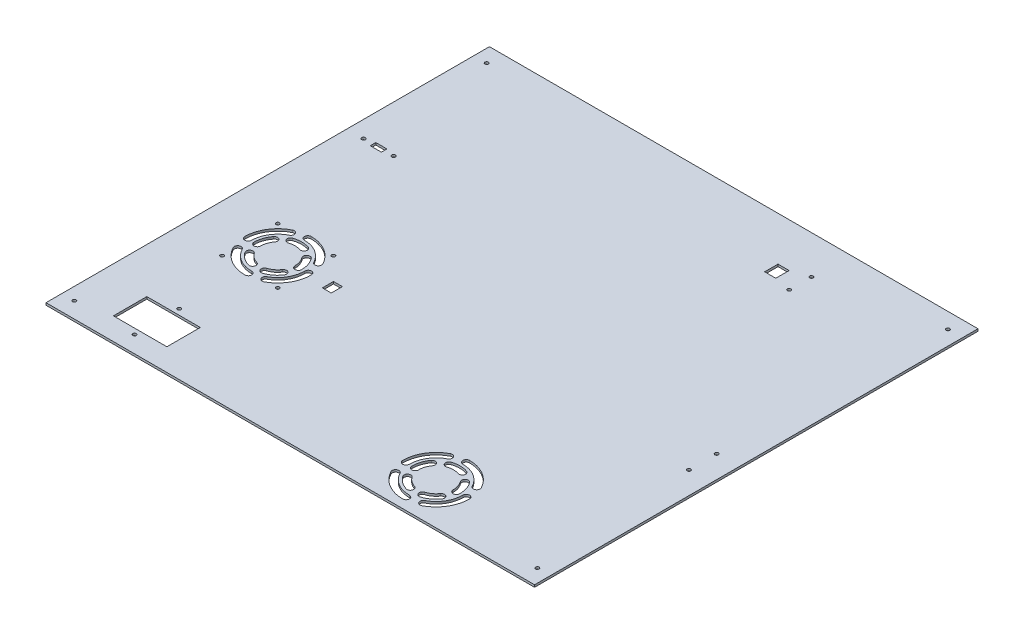
from build123d import *

# Parameters (mm, degrees)
CROQUIS1_W              = 440.5
CROQUIS1_H              = 320
SALIENTE_EXTRUIR1_DEPTH = 2
CROQUIS2_R              = 1.55
CORTAR_EXTRUIR1_DEPTH   = 2
CROQUIS3_W              = 440.5
CROQUIS3_H              = 320
CROQUIS3_W_2            = 439
CROQUIS3_H_2            = 318.5
CORTAR_EXTRUIR2_DEPTH   = 2
CROQUIS4_R              = 1.55
CORTAR_EXTRUIR3_DEPTH   = 2
CROQUIS5_R              = 1.55
CROQUIS5_W              = 48
CROQUIS5_H              = 30
CORTAR_EXTRUIR4_DEPTH   = 2
CROQUIS8_W              = 439
CROQUIS8_H              = 30
SALIENTE_EXTRUIR2_DEPTH = 2
CROQUIS10_R             = 1.75
SALIENTE_EXTRUIR3_DEPTH = 2
CROQUIS11_W             = 439
CROQUIS11_H             = 2
SALIENTE_EXTRUIR4_DEPTH = 50
CROQUIS12_R             = 1.55
CORTAR_EXTRUIR8_DEPTH   = 2
CROQUIS13_R             = 1.55
CROQUIS13_W             = 10
CROQUIS13_H             = 12
CORTAR_EXTRUIR9_DEPTH   = 2
CROQUIS14_W             = 8
CROQUIS14_H             = 10
CORTAR_EXTRUIR10_DEPTH  = 2
CROQUIS15_R             = 1.6
CORTAR_EXTRUIR11_DEPTH  = 2
CROQUIS18_W             = 0.5
CROQUIS18_H             = 398
CORTAR_EXTRUIR13_DEPTH  = 2
CROQUIS19_R             = 1.65
CROQUIS19_W             = 10
CROQUIS19_H             = 5
CORTAR_EXTRUIR14_DEPTH  = 2


with BuildPart() as part:
    # Croquis1 → Saliente-Extruir1 (new body)
    with BuildSketch(Plane(origin=(0, 0, 0), x_dir=(1, 0, 0), z_dir=(0, 1, 0))):
        with Locations((220.25, 160)):
            Rectangle(CROQUIS1_W, CROQUIS1_H)
    extrude(amount=SALIENTE_EXTRUIR1_DEPTH)

    # Croquis2 → Cortar-Extruir1 (cut)
    with BuildSketch(Plane(origin=(0, 2, 0), x_dir=(1, 0, 0), z_dir=(0, 1, 0))):
        with Locations(Location((12.5, 305, 0), (0, 0, 270))):
            Circle(CROQUIS2_R)
        with Locations(Location((428, 305, 0), (0, 0, 90))):
            Circle(CROQUIS2_R)
        with Locations(Location((428, 15, 0), (0, 0, 270))):
            Circle(CROQUIS2_R)
        with Locations(Location((12.5, 15, 0), (0, 0, 90))):
            Circle(CROQUIS2_R)
    extrude(amount=-CORTAR_EXTRUIR1_DEPTH, mode=Mode.SUBTRACT)

    # Croquis3 → Cortar-Extruir2 (cut)
    with BuildSketch(Plane(origin=(0, 2, 0), x_dir=(1, 0, 0), z_dir=(0, 1, 0))):
        with Locations((220.25, 160)):
            Rectangle(CROQUIS3_W, CROQUIS3_H)
        with Locations((220.25, 160)):
            Rectangle(CROQUIS3_W_2, CROQUIS3_H_2, mode=Mode.SUBTRACT)
    extrude(amount=-CORTAR_EXTRUIR2_DEPTH, mode=Mode.SUBTRACT)

    # Croquis4 → Cortar-Extruir3 (cut)
    with BuildSketch(Plane(origin=(0, 2, 0), x_dir=(1, 0, 0), z_dir=(0, 1, 0))):
        with Locations(Location((93.75, 166.25, 0), (0, 0, 270))):
            Circle(CROQUIS4_R)
        with Locations(Location((93.75, 116.25, 0), (0, 0, 270))):
            Circle(CROQUIS4_R)
        with Locations(Location((43.75, 116.25, 0), (0, 0, 270))):
            Circle(CROQUIS4_R)
        with Locations(Location((43.75, 166.25, 0), (0, 0, 270))):
            Circle(CROQUIS4_R)
        with BuildLine():
            ThreePointArc((340.502065733, 52.118312757), (329.455555556, 63.901991957), (313.9, 68.25))
            ThreePointArc((313.9, 68.25), (310.9, 65.25), (313.9, 62.25))
            ThreePointArc((313.9, 62.25), (326.344444444, 58.771593566), (335.181652586, 49.344650206))
            ThreePointArc((335.181652586, 49.344650206), (339.228690436, 48.071274908), (340.502065733, 52.118312757))
        make_face()
        with BuildLine():
            ThreePointArc((324.994650206, 16.968347414), (334.421593566, 25.805555556), (337.9, 38.25))
            ThreePointArc((337.9, 38.25), (340.9, 41.25), (343.9, 38.25))
            ThreePointArc((343.9, 38.25), (339.551991957, 22.694444444), (327.768312757, 11.647934267))
            ThreePointArc((327.768312757, 11.647934267), (323.721274908, 12.921309564), (324.994650206, 16.968347414))
        make_face()
        with BuildLine():
            ThreePointArc((292.618347414, 27.155349794), (301.455555556, 17.728406434), (313.9, 14.25))
            ThreePointArc((313.9, 14.25), (316.9, 11.25), (313.9, 8.25))
            ThreePointArc((313.9, 8.25), (298.344444444, 12.598008043), (287.297934267, 24.381687243))
            ThreePointArc((287.297934267, 24.381687243), (288.571309564, 28.428725092), (292.618347414, 27.155349794))
        make_face()
        with BuildLine():
            ThreePointArc((302.805349794, 59.531652586), (293.378406434, 50.694444444), (289.9, 38.25))
            ThreePointArc((289.9, 38.25), (286.9, 35.25), (283.9, 38.25))
            ThreePointArc((283.9, 38.25), (288.248008043, 53.805555556), (300.031687243, 64.852065733))
            ThreePointArc((300.031687243, 64.852065733), (304.078725092, 63.578690436), (302.805349794, 59.531652586))
        make_face()
        with BuildLine():
            ThreePointArc((320.872972973, 58.587837838), (313.9, 59.75), (306.927027027, 58.587837838))
            ThreePointArc((306.927027027, 58.587837838), (305.062162162, 54.777027027), (308.872972973, 52.912162162))
            ThreePointArc((308.872972973, 52.912162162), (313.9, 53.75), (318.927027027, 52.912162162))
            ThreePointArc((318.927027027, 52.912162162), (322.737837838, 54.777027027), (320.872972973, 58.587837838))
        make_face()
        with BuildLine():
            ThreePointArc((335.397200353, 37.903046137), (334.3477151, 44.893865379), (331.087666053, 51.166428905))
            ThreePointArc((331.087666053, 51.166428905), (326.887094664, 51.762415483), (326.291108085, 47.561844094))
            ThreePointArc((326.291108085, 47.561844094), (328.641376003, 43.039763413), (329.39798165, 37.999870471))
            ThreePointArc((329.39798165, 37.999870471), (332.349178834, 34.951848952), (335.397200353, 37.903046137))
        make_face()
        with BuildLine():
            ThreePointArc((320.213027508, 17.697732882), (326.537382924, 20.856134621), (331.495534781, 25.894954238))
            ThreePointArc((331.495534781, 25.894954238), (330.764303755, 30.074105012), (326.585152982, 29.342873986))
            ThreePointArc((326.585152982, 29.342873986), (323.010671411, 25.710236587), (318.45125239, 23.433249287))
            ThreePointArc((318.45125239, 23.433249287), (316.464381746, 19.684603525), (320.213027508, 17.697732882))
        make_face()
        with BuildLine():
            ThreePointArc((296.304465219, 25.894954238), (301.262617076, 20.856134621), (307.586972492, 17.697732882))
            ThreePointArc((307.586972492, 17.697732882), (311.335618254, 19.684603525), (309.34874761, 23.433249287))
            ThreePointArc((309.34874761, 23.433249287), (304.789328589, 25.710236587), (301.214847018, 29.342873986))
            ThreePointArc((301.214847018, 29.342873986), (297.035696245, 30.074105012), (296.304465219, 25.894954238))
        make_face()
        with BuildLine():
            ThreePointArc((296.712333947, 51.166428905), (293.4522849, 44.893865379), (292.402799647, 37.903046137))
            ThreePointArc((292.402799647, 37.903046137), (295.450821166, 34.951848952), (298.40201835, 37.999870471))
            ThreePointArc((298.40201835, 37.999870471), (299.158623997, 43.039763413), (301.508891915, 47.561844094))
            ThreePointArc((301.508891915, 47.561844094), (300.912905336, 51.762415483), (296.712333947, 51.166428905))
        make_face()
        with BuildLine():
            ThreePointArc((95.352065733, 155.118312757), (84.305555556, 166.901991957), (68.75, 171.25))
            ThreePointArc((68.75, 171.25), (65.75, 168.25), (68.75, 165.25))
            ThreePointArc((68.75, 165.25), (81.194444444, 161.771593566), (90.031652586, 152.344650206))
            ThreePointArc((90.031652586, 152.344650206), (94.078690436, 151.071274908), (95.352065733, 155.118312757))
        make_face()
        with BuildLine():
            ThreePointArc((82.950789921, 114.823922622), (94.569359948, 125.9738535), (98.74873756, 141.525217776))
            ThreePointArc((98.74873756, 141.525217776), (95.721342026, 144.497569754), (92.748990048, 141.470174221))
            ThreePointArc((92.748990048, 141.470174221), (89.405487958, 129.0290828), (80.110631937, 120.109138097))
            ThreePointArc((80.110631937, 120.109138097), (78.888103191, 116.046451367), (82.950789921, 114.823922622))
        make_face()
        with BuildLine():
            ThreePointArc((75.722972973, 161.587837838), (68.75, 162.75), (61.777027027, 161.587837838))
            ThreePointArc((61.777027027, 161.587837838), (59.912162162, 157.777027027), (63.722972973, 155.912162162))
            ThreePointArc((63.722972973, 155.912162162), (68.75, 156.75), (73.777027027, 155.912162162))
            ThreePointArc((73.777027027, 155.912162162), (77.587837838, 157.777027027), (75.722972973, 161.587837838))
        make_face()
        with BuildLine():
            ThreePointArc((42.397934267, 127.631687243), (53.442433173, 115.841965669), (69.027211601, 111.588358702))
            ThreePointArc((69.027211601, 111.588358702), (71.999044435, 114.616263854), (68.971139283, 117.588096688))
            ThreePointArc((68.971139283, 117.588096688), (56.538734866, 120.981315416), (47.728235722, 130.386299084))
            ThreePointArc((47.728235722, 130.386299084), (43.685779074, 131.674143891), (42.397934267, 127.631687243))
        make_face()
        with BuildLine():
            ThreePointArc((55.326045135, 167.800375436), (43.473033574, 156.940760603), (39, 141.5))
            ThreePointArc((39, 141.5), (41.974684887, 138.474896725), (44.999788162, 141.449581612))
            ThreePointArc((44.999788162, 141.449581612), (48.570729168, 153.776349184), (58.03330179, 162.445866924))
            ThreePointArc((58.03330179, 162.445866924), (59.356927718, 166.476749507), (55.326045135, 167.800375436))
        make_face()
        with BuildLine():
            ThreePointArc((90.249927932, 141.194331889), (89.143285307, 148.059105257), (85.903574688, 154.211669469))
            ThreePointArc((85.903574688, 154.211669469), (81.701447596, 154.796586476), (81.116530589, 150.594459385))
            ThreePointArc((81.116530589, 150.594459385), (83.452135919, 146.158889836), (84.249948044, 141.209867176))
            ThreePointArc((84.249948044, 141.209867176), (87.242170344, 138.202109589), (90.249927932, 141.194331889))
        make_face()
        with BuildLine():
            ThreePointArc((75.412235869, 120.80826296), (81.696671654, 124.085102882), (86.574217683, 129.227218958))
            ThreePointArc((86.574217683, 129.227218958), (85.764714896, 133.391916454), (81.600017399, 132.582413667))
            ThreePointArc((81.600017399, 132.582413667), (78.083647006, 128.875306729), (73.553007255, 126.512933762))
            ThreePointArc((73.553007255, 126.512933762), (71.630286161, 122.730984053), (75.412235869, 120.80826296))
        make_face()
        with BuildLine():
            ThreePointArc((51.404465219, 129.144954238), (56.370569041, 124.099215794), (62.723525964, 120.974859546))
            ThreePointArc((62.723525964, 120.974859546), (66.453929496, 122.99577258), (64.433016462, 126.726176112))
            ThreePointArc((64.433016462, 126.726176112), (59.882161304, 128.964266645), (56.324759692, 132.578713446))
            ThreePointArc((56.324759692, 132.578713446), (52.147732852, 133.321981079), (51.404465219, 129.144954238))
        make_face()
        with BuildLine():
            ThreePointArc((52.00944156, 154.334594989), (48.645130887, 148.123657021), (47.502799647, 141.153046137))
            ThreePointArc((47.502799647, 141.153046137), (50.516457679, 138.166766635), (53.502737181, 141.180424667))
            ThreePointArc((53.502737181, 141.180424667), (54.322488695, 146.182624222), (56.736761078, 150.639672774))
            ThreePointArc((56.736761078, 150.639672774), (56.220562427, 154.85079364), (52.00944156, 154.334594989))
        make_face()
    extrude(amount=-CORTAR_EXTRUIR3_DEPTH, mode=Mode.SUBTRACT)

    # Croquis5 → Cortar-Extruir4 (cut)
    with BuildSketch(Plane.XZ):
        with Locations(Location((65.75, -15.75, 0), (0, 0, 270))):
            Circle(CROQUIS5_R)
        with Locations(Location((65.75, -55.75, 0), (0, 0, 270))):
            Circle(CROQUIS5_R)
        with Locations((65.75, -35.75)):
            Rectangle(CROQUIS5_W, CROQUIS5_H)
    extrude(amount=-CORTAR_EXTRUIR4_DEPTH, mode=Mode.SUBTRACT)

    # Croquis8 → Saliente-Extruir2 (add)
    with BuildSketch(Plane.XZ):
        with Locations((220.25, -334.25)):
            Rectangle(CROQUIS8_W, CROQUIS8_H)
    extrude(amount=-SALIENTE_EXTRUIR2_DEPTH)

    # Croquis10 → Saliente-Extruir3 (add)
    with BuildSketch(Plane.XZ):
        with Locations((428, -305)):
            Circle(CROQUIS10_R)
        with Locations((12.5, -305)):
            Circle(CROQUIS10_R)
    extrude(amount=-SALIENTE_EXTRUIR3_DEPTH)

    # Croquis11 → Saliente-Extruir4 (add)
    with BuildSketch(Plane(origin=(0, 0, -349.25), x_dir=(-1, 0, 0), z_dir=(0, 0, -1))):
        with Locations((-220.25, 1)):
            Rectangle(CROQUIS11_W, CROQUIS11_H)
    extrude(amount=SALIENTE_EXTRUIR4_DEPTH)

    # Croquis12 → Cortar-Extruir8 (cut)
    with BuildSketch(Plane.XZ):
        with Locations(Location((426.75, -384.75, 0), (0, 0, 270))):
            Circle(CROQUIS12_R)
        with Locations(Location((12.75, -384.75, 0), (0, 0, 270))):
            Circle(CROQUIS12_R)
    extrude(amount=-CORTAR_EXTRUIR8_DEPTH, mode=Mode.SUBTRACT)

    # Croquis13 → Cortar-Extruir9 (cut)
    with BuildSketch(Plane.XZ):
        with Locations(Location((324.75, -364.25, 0), (0, 0, 270))):
            Circle(CROQUIS13_R)
        with Locations(Location((324.75, -344.25, 0), (0, 0, 270))):
            Circle(CROQUIS13_R)
        with Locations((304.75, -353.25)):
            Rectangle(CROQUIS13_W, CROQUIS13_H)
    extrude(amount=-CORTAR_EXTRUIR9_DEPTH, mode=Mode.SUBTRACT)

    # Croquis14 → Cortar-Extruir10 (cut)
    with BuildSketch(Plane.XZ):
        with Locations((117.75, -141.25)):
            Rectangle(CROQUIS14_W, CROQUIS14_H)
    extrude(amount=-CORTAR_EXTRUIR10_DEPTH, mode=Mode.SUBTRACT)

    # Croquis15 → Cortar-Extruir11 (cut)
    with BuildSketch(Plane.XZ):
        with Locations(Location((419.75, -184.25, 0), (0, 0, 270))):
            Circle(CROQUIS15_R)
        with Locations(Location((419.75, -159.25, 0), (0, 0, 270))):
            Circle(CROQUIS15_R)
    extrude(amount=-CORTAR_EXTRUIR11_DEPTH, mode=Mode.SUBTRACT)

    # Croquis18 → Cortar-Extruir13 (cut)
    with BuildSketch(Plane.XZ):
        Polygon((0.75, -399.25), (439.75, -399.25), (439.75, -398.75), (1.25, -398.75), (0.75, -398.75), align=None)
        with Locations((1, -199.75)):
            Rectangle(CROQUIS18_W, CROQUIS18_H)
    extrude(amount=-CORTAR_EXTRUIR13_DEPTH, mode=Mode.SUBTRACT)

    # Croquis19 → Cortar-Extruir14 (cut)
    with BuildSketch(Plane.XZ):
        with Locations(Location((16.25, -270.75, 0), (0, 0, 270))):
            Circle(CROQUIS19_R)
        with Locations(Location((43.25, -270.75, 0), (0, 0, 270))):
            Circle(CROQUIS19_R)
        with Locations((29.75, -270.75)):
            Rectangle(CROQUIS19_W, CROQUIS19_H)
    extrude(amount=-CORTAR_EXTRUIR14_DEPTH, mode=Mode.SUBTRACT)


solid = part.part
